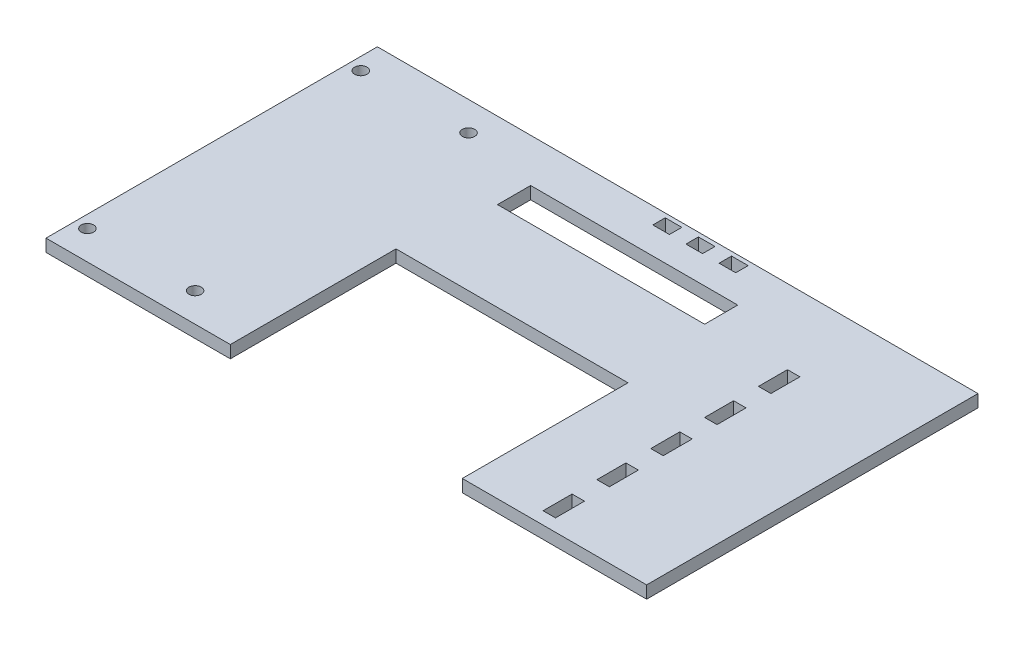
from build123d import *

# Parameters (mm, degrees)
SKETCH1_R           = 1.5
SKETCH1_W           = 3
SKETCH1_H           = 7
SKETCH1_W_2         = 4
SKETCH1_H_2         = 3
BOSS_EXTRUDE1_DEPTH = 3
SKETCH5_W           = 50
SKETCH5_H           = 8
CUT_EXTRUDE1_DEPTH  = 10


with BuildPart() as part:
    # Sketch1 → Boss-Extrude1 (new body)
    with BuildSketch(Plane(origin=(0, 0, 0), x_dir=(1, 0, 0), z_dir=(0, 1, 0))):
        Polygon((-72.5, -40), (-28, -40), (-28, 0), (28, 0), (28, -40), (72.5, -40), (72.5, 40), (-72.5, 40), align=None)
        with Locations(Location((-69.5, 33, 0), (0, 0, 270))):
            Circle(SKETCH1_R, mode=Mode.SUBTRACT)
        with Locations(Location((-43.5, 33, 0), (0, 0, 270))):
            Circle(SKETCH1_R, mode=Mode.SUBTRACT)
        with Locations(Location((-43.5, -33, 0), (0, 0, 270))):
            Circle(SKETCH1_R, mode=Mode.SUBTRACT)
        with Locations(Location((-69.5, -33, 0), (0, 0, 270))):
            Circle(SKETCH1_R, mode=Mode.SUBTRACT)
        with Locations((46, 5.5)):
            Rectangle(SKETCH1_W, SKETCH1_H, mode=Mode.SUBTRACT)
        with Locations((46, 18.5)):
            Rectangle(SKETCH1_W, SKETCH1_H, mode=Mode.SUBTRACT)
        with Locations((46, -7.5)):
            Rectangle(SKETCH1_W, SKETCH1_H, mode=Mode.SUBTRACT)
        with Locations((46, -20.5)):
            Rectangle(SKETCH1_W, SKETCH1_H, mode=Mode.SUBTRACT)
        with Locations((46, -33.5)):
            Rectangle(SKETCH1_W, SKETCH1_H, mode=Mode.SUBTRACT)
        with Locations((0, 37.5)):
            Rectangle(SKETCH1_W_2, SKETCH1_H_2, mode=Mode.SUBTRACT)
        with Locations((8, 37.5)):
            Rectangle(SKETCH1_W_2, SKETCH1_H_2, mode=Mode.SUBTRACT)
        with Locations((16, 37.5)):
            Rectangle(SKETCH1_W_2, SKETCH1_H_2, mode=Mode.SUBTRACT)
    extrude(amount=BOSS_EXTRUDE1_DEPTH)

    # Sketch5 → Cut-Extrude1 (cut)
    with BuildSketch(Plane.XZ):
        with Locations((0, -25.5)):
            Rectangle(SKETCH5_W, SKETCH5_H)
    extrude(amount=-CUT_EXTRUDE1_DEPTH, mode=Mode.SUBTRACT)


solid = part.part
